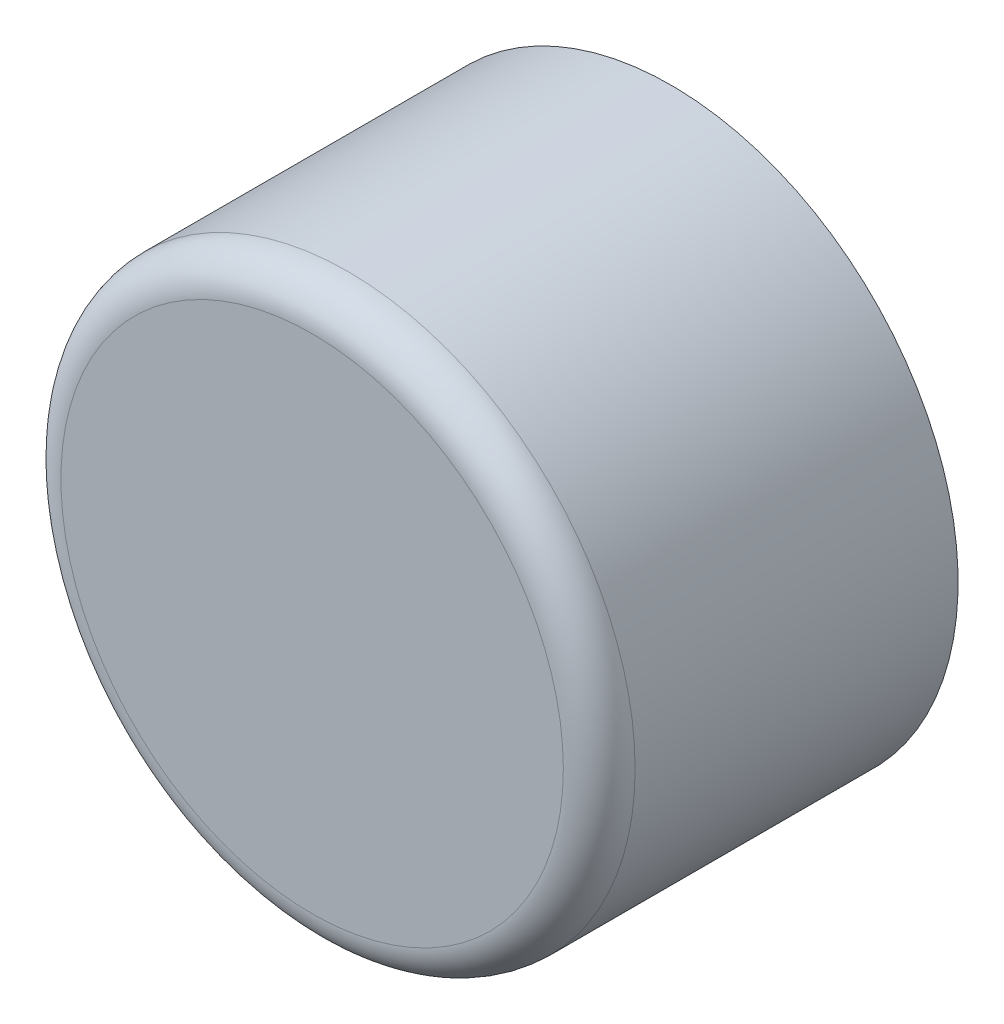
from build123d import *

# Parameters (mm, degrees)
SKETCH1_R           = 80
BOSS_EXTRUDE1_DEPTH = 100
FILLET1_R           = 10


with BuildPart() as part:
    # Sketch1 → Boss-Extrude1 (new body)
    with BuildSketch(Plane.XY):
        with Locations(Location((0, 0, 0), (0, 0, 180))):
            Circle(SKETCH1_R)
    extrude(amount=BOSS_EXTRUDE1_DEPTH)

    # Fillet1
    fillet1_edges = [part.edges().sort_by_distance(p)[0] for p in [
        (80, 0, 100),
    ]]
    fillet(fillet1_edges, radius=FILLET1_R)


solid = part.part
